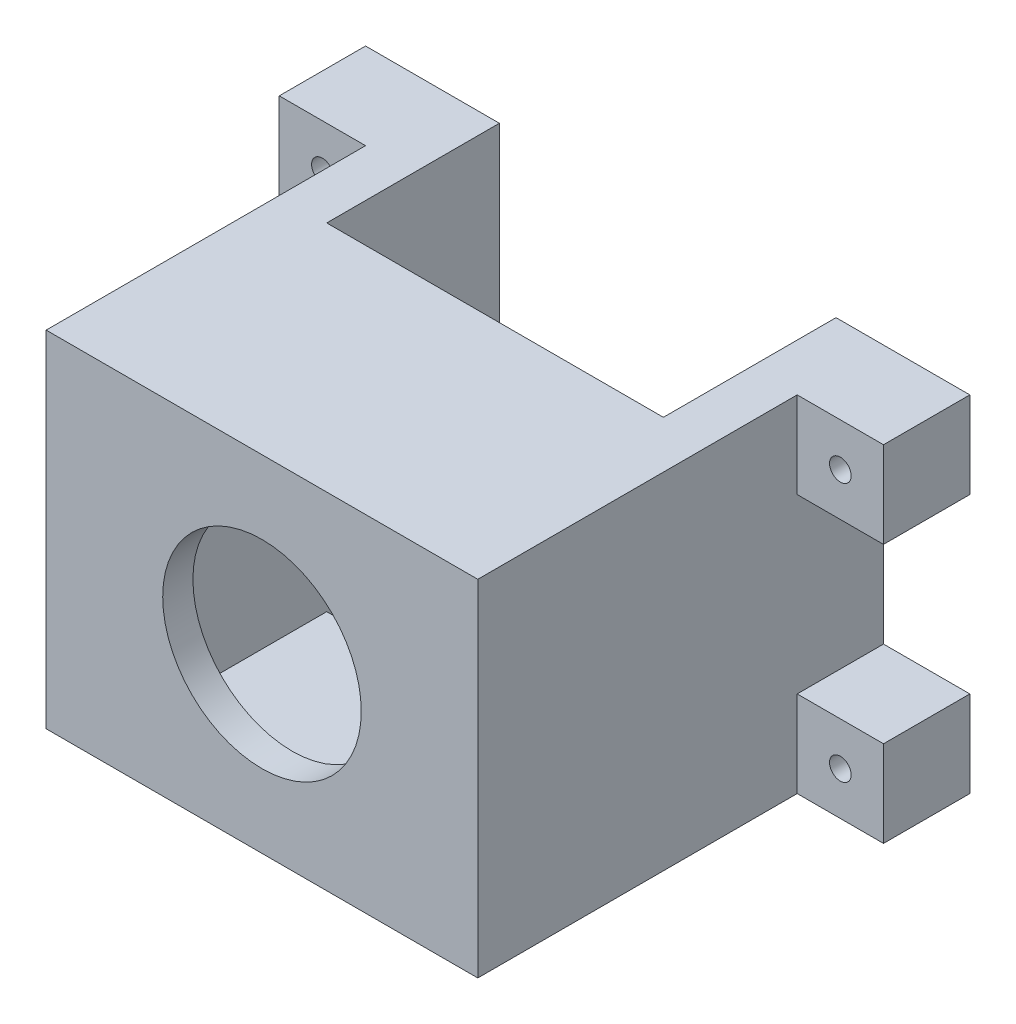
from build123d import *

# Parameters (mm, degrees)
SKETCH_1_W               = 50
SKETCH_1_H               = 40
EXTRUDE_2_DEPTH          = 47
SKETCH_3_W               = 70
SKETCH_3_H               = 10
EXTRUDE_3_DEPTH          = 10
CUT_EXTRUDE_1_DEPTH      = 62.919302322
CUT_EXTRUDE_1_DEPTH_BACK = 62.919302322
SKETCH_4_R               = 11.5
SKETCH_5_W               = 39
SKETCH_5_H               = 38
CUT_EXTRUDE_2_DEPTH      = 43.5
M3X0_5_1_D               = 2.5
SKETCH_8_W               = 39
SKETCH_8_H               = 70
CUT_EXTRUDE_3_DEPTH      = 20


with BuildPart() as part:
    # ｽｹｯﾁ1 → ﾎﾞｽ - 押し出し2 (new body)
    with BuildSketch(Plane.XY):
        Rectangle(SKETCH_1_W, SKETCH_1_H)
    extrude(amount=EXTRUDE_2_DEPTH)

    # ｽｹｯﾁ3 → ﾎﾞｽ - 押し出し3 (add)
    with BuildSketch(Plane.XY):
        with Locations((0, -15)):
            Rectangle(SKETCH_3_W, SKETCH_3_H)
    extrude_3 = extrude(amount=EXTRUDE_3_DEPTH)

    # ｽｹｯﾁ4 → ｶｯﾄ - 押し出し1 (cut, two sides: drawn at the far end of the back side and taken through both)
    with BuildSketch(Plane.XY.offset(-CUT_EXTRUDE_1_DEPTH_BACK)):
        Circle(SKETCH_4_R)
    extrude(amount=CUT_EXTRUDE_1_DEPTH + CUT_EXTRUDE_1_DEPTH_BACK, mode=Mode.SUBTRACT)

    # ｽｹｯﾁ5 → ｶｯﾄ - 押し出し2 (cut)
    with BuildSketch(Plane.XY):
        Rectangle(SKETCH_5_W, SKETCH_5_H)
    cut_extrude_2 = extrude(amount=CUT_EXTRUDE_2_DEPTH, mode=Mode.SUBTRACT)

    # M3x0.5 ねじ穴1 (through all)
    with Locations(Plane.XY.offset(10)):
        with Locations((30, -15), (-30, -15)):
            m3x0_5_1 = Hole(M3X0_5_1_D / 2)

    # ｽｹｯﾁ8 → ｶｯﾄ - 押し出し3 (cut)
    with BuildSketch(Plane(origin=(0, 0, 0), x_dir=(-1, 0, 0), z_dir=(0, 0, -1))):
        Rectangle(SKETCH_8_W, SKETCH_8_H)
    cut_extrude_3 = extrude(amount=-CUT_EXTRUDE_3_DEPTH, mode=Mode.SUBTRACT)

    # ﾐﾗｰ4: ﾎﾞｽ - 押し出し3, ｶｯﾄ - 押し出し2, M3x0.5 ねじ穴1, ｶｯﾄ - 押し出し3 across plane
    add(extrude_3.mirror(Plane.ZX))
    add(cut_extrude_2.mirror(Plane.ZX), mode=Mode.SUBTRACT)
    add(m3x0_5_1.mirror(Plane.ZX), mode=Mode.SUBTRACT)
    add(cut_extrude_3.mirror(Plane.ZX), mode=Mode.SUBTRACT)


solid = part.part
